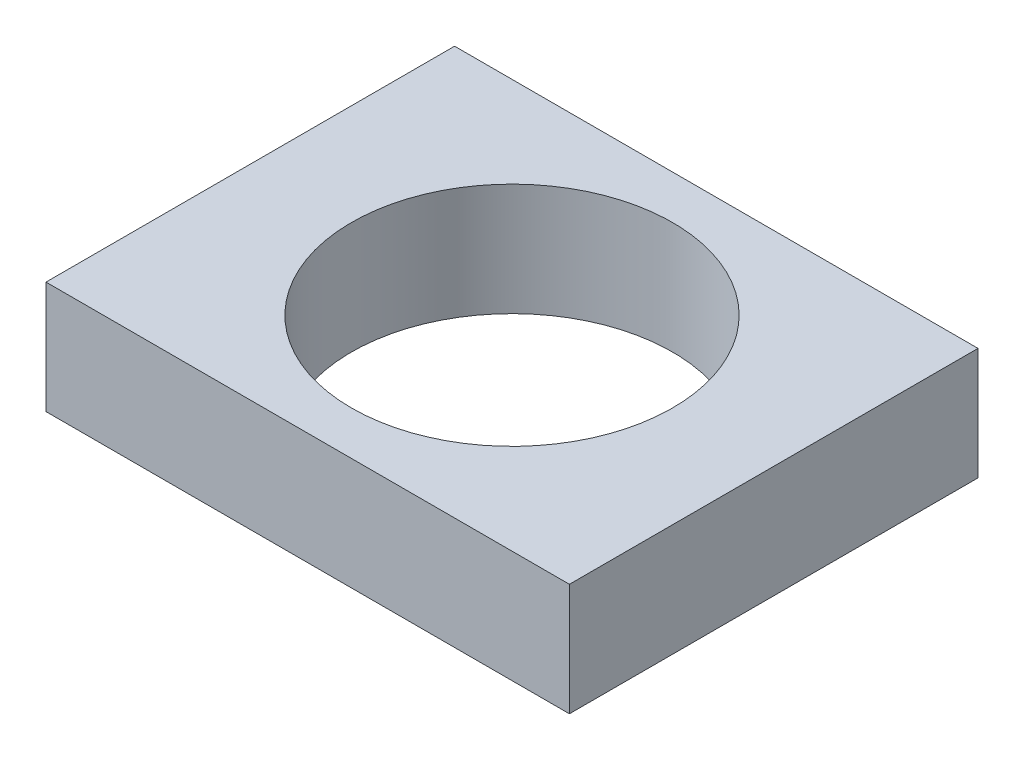
from build123d import *

# Parameters (mm, degrees)
SKETCH3_W      = 59.255118266
SKETCH3_H      = 46.256497387
SKETCH3_R      = 18.182165495
EXTRUDE3_DEPTH = 12.7


with BuildPart() as part:
    # Sketch3 → Extrude3 (new body)
    with BuildSketch(Plane(origin=(0, 0, 0), x_dir=(1, 0, 0), z_dir=(0, 1, 0))):
        with Locations((29.627559133, 23.128248694)):
            Rectangle(SKETCH3_W, SKETCH3_H)
        with Locations(Location((29.627559133, 23.128248694, 0), (0, 0, 270))):
            Circle(SKETCH3_R, mode=Mode.SUBTRACT)
    extrude(amount=-EXTRUDE3_DEPTH)


solid = part.part
